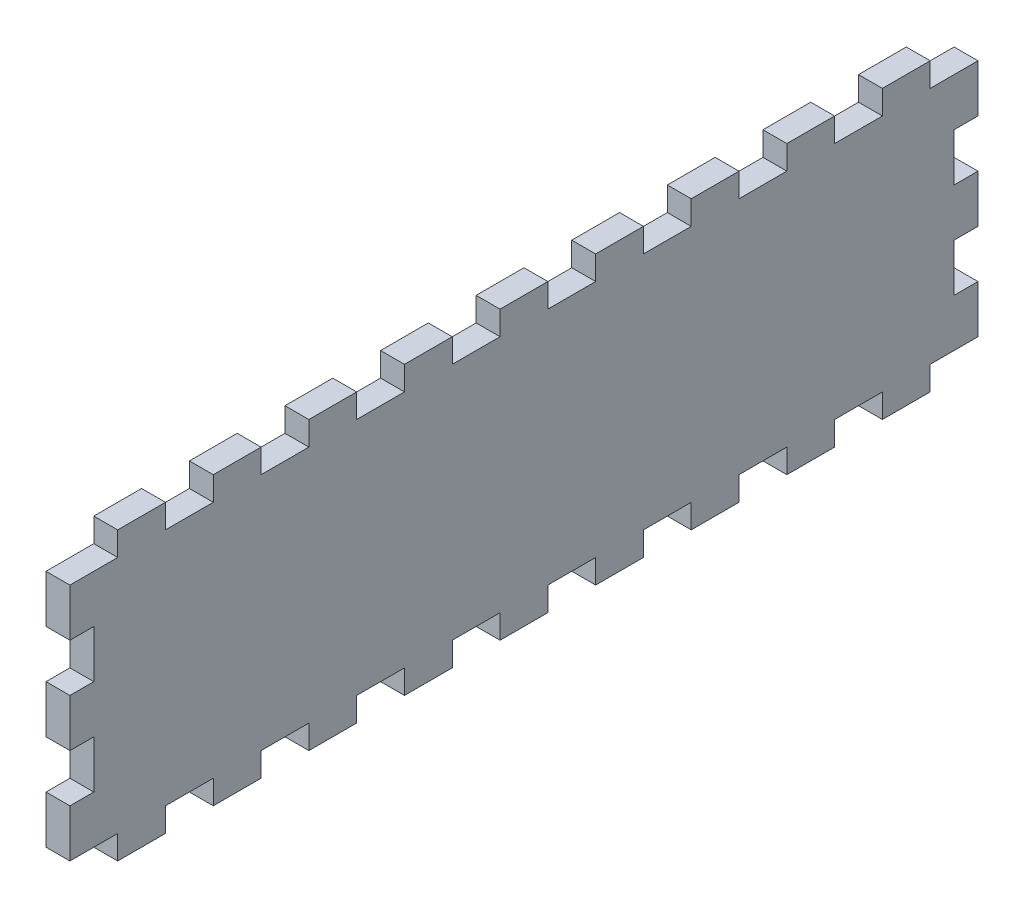
from build123d import *

# Parameters (mm, degrees)
BOSS_EXTRUDE3_DEPTH = 5


with BuildPart() as part:
    # Sketch2 → Boss-Extrude3 (new body)
    with BuildSketch(Plane(origin=(0, 0, 0), x_dir=(0, 0, -1), z_dir=(1, 0, 0))):
        Polygon((-30.089594047, -3.36324765), (-30.089594047, 1.63675235), (-40.089594047, 1.63675235), (-40.089594047, -3.36324765), (-50.089594047, -3.36324765), (-50.089594047, 1.63675235), (-60.089594047, 1.63675235), (-60.089594047, -3.36324765), (-70.089594047, -3.36324765), (-70.089594047, 1.63675235), (-80.089594047, 1.63675235), (-80.089594047, -3.36324765), (-90.089594047, -3.36324765), (-90.089594047, 1.63675235), (-100.089594047, 1.63675235), (-100.089594047, -3.36324765), (-110.089594047, -3.36324765), (-110.089594047, 1.63675235), (-120.089594047, 1.63675235), (-120.089594047, -3.36324765), (-130.089594047, -3.36324765), (-130.089594047, 1.63675235), (-140.089594047, 1.63675235), (-140.089594047, -3.36324765), (-150.089594047, -3.36324765), (-150.089594047, 1.63675235), (-160.089594047, 1.63675235), (-160.089594047, -3.36324765), (-170.089594047, -3.36324765), (-170.089594047, 1.63675235), (-180.089594047, 1.63675235), (-180.089594047, -3.36324765), (-190.089594047, -3.36324765), (-190.089594047, 1.63675235), (-200.089594047, 1.63675235), (-200.089594047, -3.36324765), (-210.089594047, -3.36324765), (-210.089594047, -13.36324765), (-205.089594047, -13.36324765), (-205.089594047, -23.36324765), (-210.089594047, -23.36324765), (-210.089594047, -33.36324765), (-205.089594047, -33.36324765), (-205.089594047, -43.36324765), (-210.089594047, -43.36324765), (-210.089594047, -53.36324765), (-200.089594047, -53.36324765), (-200.089594047, -58.36324765), (-190.089594047, -58.36324765), (-190.089594047, -53.36324765), (-180.089594047, -53.36324765), (-180.089594047, -58.36324765), (-170.089594047, -58.36324765), (-170.089594047, -53.36324765), (-160.089594047, -53.36324765), (-160.089594047, -58.36324765), (-150.089594047, -58.36324765), (-150.089594047, -53.36324765), (-140.089594047, -53.36324765), (-140.089594047, -58.36324765), (-130.089594047, -58.36324765), (-130.089594047, -53.36324765), (-120.089594047, -53.36324765), (-120.089594047, -58.36324765), (-110.089594047, -58.36324765), (-110.089594047, -53.36324765), (-100.089594047, -53.36324765), (-100.089594047, -58.36324765), (-90.089594047, -58.36324765), (-90.089594047, -53.36324765), (-80.089594047, -53.36324765), (-80.089594047, -58.36324765), (-70.089594047, -58.36324765), (-70.089594047, -53.36324765), (-60.089594047, -53.36324765), (-60.089594047, -58.36324765), (-50.089594047, -58.36324765), (-50.089594047, -53.36324765), (-40.089594047, -53.36324765), (-40.089594047, -58.36324765), (-30.089594047, -58.36324765), (-30.089594047, -53.36324765), (-20.089594047, -53.36324765), (-20.089594047, -43.36324765), (-25.089594047, -43.36324765), (-25.089594047, -33.36324765), (-20.089594047, -33.36324765), (-20.089594047, -23.36324765), (-25.089594047, -23.36324765), (-25.089594047, -13.36324765), (-20.089594047, -13.36324765), (-20.089594047, -3.36324765), align=None)
    extrude(amount=BOSS_EXTRUDE3_DEPTH)


solid = part.part
